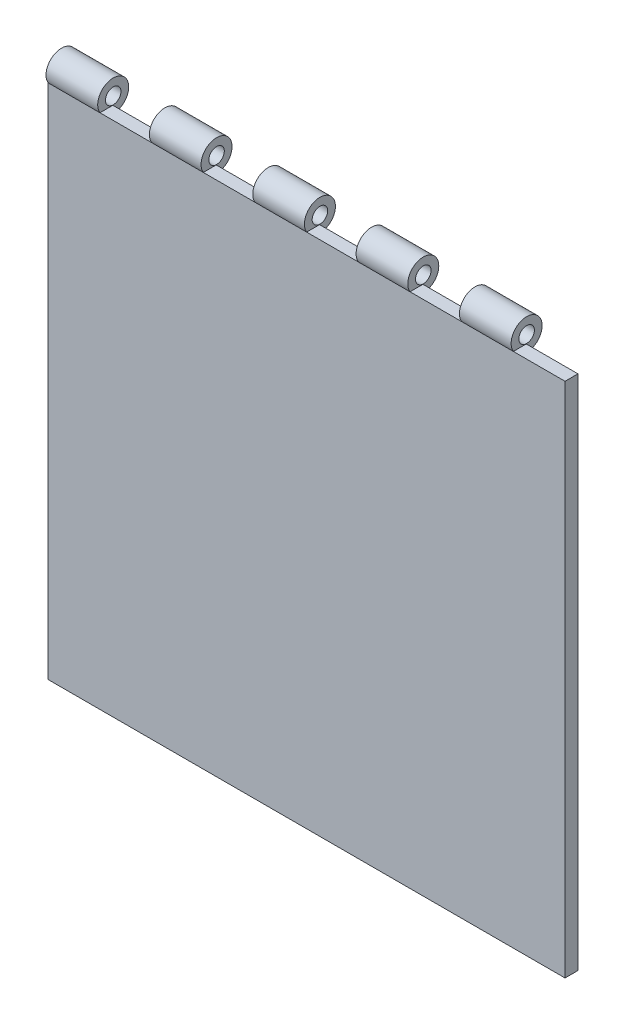
from build123d import *

# Parameters (mm, degrees)
SKETCH1_W           = 254
SKETCH1_H           = 254
BOSS_EXTRUDE1_DEPTH = 3.175
SKETCH2_R           = 7.62
SKETCH2_R_2         = 3.81
BOSS_EXTRUDE2_DEPTH = 25.4
LPATTERN1_COUNT     = 5
LPATTERN1_PITCH     = 50.8
SCALE1_SCALE        = 0.9


with BuildPart() as part:
    # Sketch1 → Boss-Extrude1 (new, symmetric)
    with BuildSketch(Plane.XY):
        with Locations((127, 127)):
            Rectangle(SKETCH1_W, SKETCH1_H)
    extrude(amount=BOSS_EXTRUDE1_DEPTH, both=True)

    # Sketch2 → Boss-Extrude2 (add)
    with BuildSketch(Plane.ZY):
        with Locations((-3.35543862, 257.92654701)):
            Circle(SKETCH2_R)
        with Locations(Location((-3.35543862, 257.92654701, 0), (0, 0, 270))):
            Circle(SKETCH2_R_2, mode=Mode.SUBTRACT)
    boss_extrude2 = extrude(amount=-BOSS_EXTRUDE2_DEPTH)

    # LPattern1: Boss-Extrude2 ×5
    with Locations(*[(i * LPATTERN1_PITCH, 0, 0) for i in range(1, LPATTERN1_COUNT)]):
        add(boss_extrude2)


with BuildPart() as part_1:
    # Scale1: scaled about (126.542998423, 131.737903525, -0.133748204)
    add(part.part.scale(SCALE1_SCALE).moved(Location((12.654299842, 13.173790352, -0.01337482))))


solid = part_1.part
